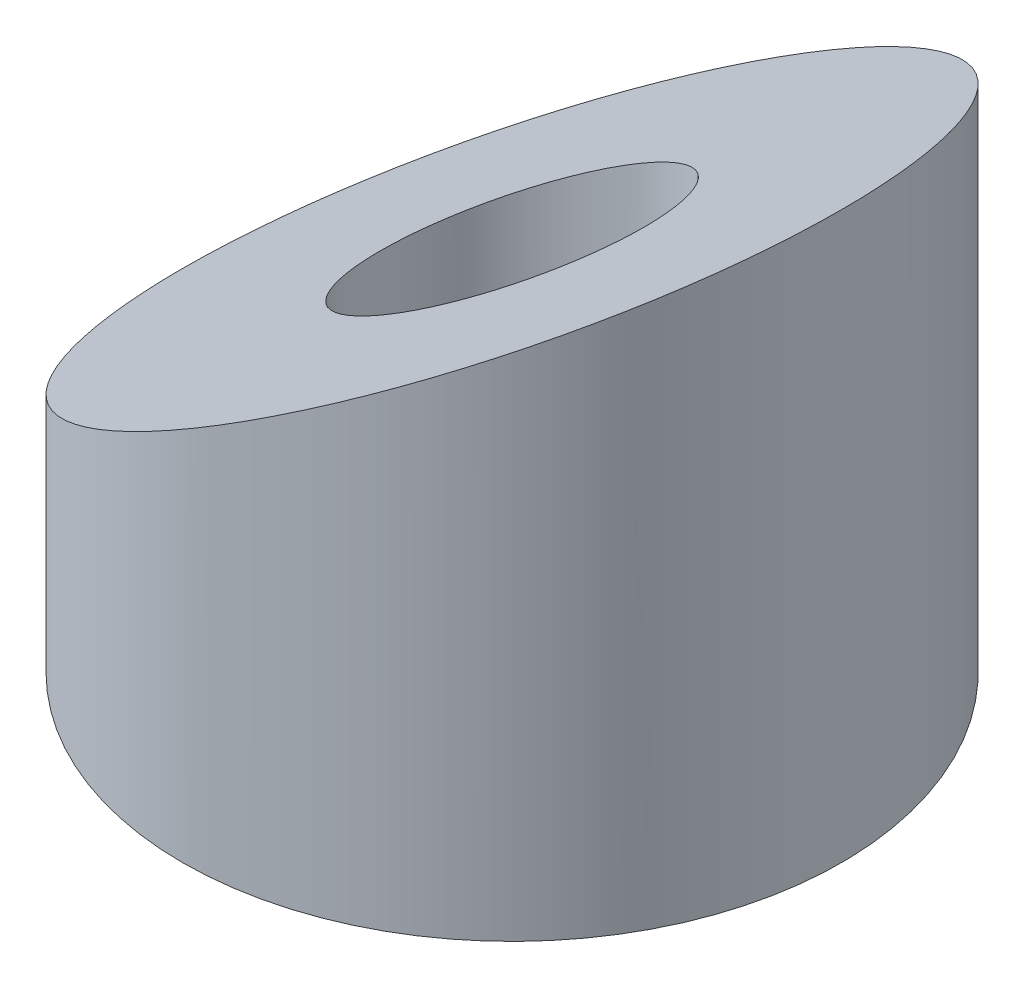
from build123d import *

# Parameters (mm, degrees)
SKETCH_1_R               = 2.5
SKETCH_1_R_2             = 1
EXTRUDE_1_DEPTH          = 4.29
CUT_EXTRUDE_1_DEPTH      = 6.559145618
CUT_EXTRUDE_1_DEPTH_BACK = 6.559145618


with BuildPart() as part:
    # 草图1 → 凸台-拉伸1 (new body)
    with BuildSketch(Plane(origin=(0, 0, 0), x_dir=(1, 0, 0), z_dir=(0, 1, 0))):
        with Locations(Location((0, 0, 0), (0, 0, 270))):
            Circle(SKETCH_1_R)
        with Locations(Location((0, 0, 0), (0, 0, 270))):
            Circle(SKETCH_1_R_2, mode=Mode.SUBTRACT)
    extrude(amount=EXTRUDE_1_DEPTH)

    # 草图2 → 切除-拉伸1 (cut, two sides: drawn at the far end of the back side and taken through both)
    with BuildSketch(Plane.XY.offset(-CUT_EXTRUDE_1_DEPTH_BACK)):
        Polygon((2.5, 4.29), (-2.5, 1.403248654), (-2.5, 4.29), align=None)
    extrude(amount=CUT_EXTRUDE_1_DEPTH + CUT_EXTRUDE_1_DEPTH_BACK, mode=Mode.SUBTRACT)


solid = part.part
